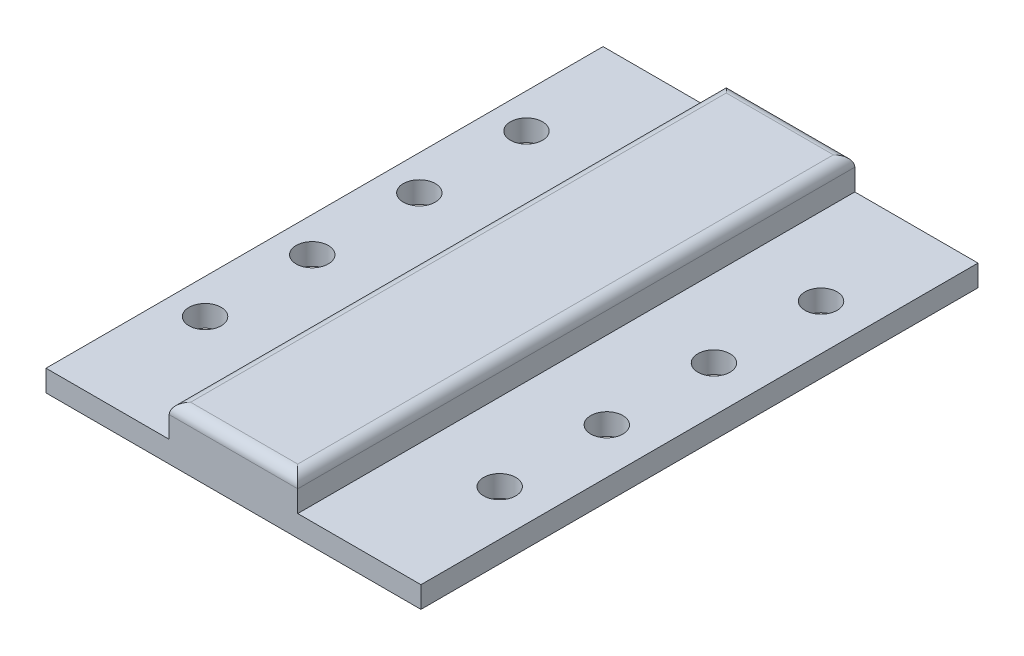
from build123d import *

# Parameters (mm, degrees)
SKETCH_1_W                  = 35
SKETCH_1_H                  = 52
EXTRUDE_1_DEPTH             = 2
EXTRUDE_2_REACH             = 33.405
SKETCH_2_W                  = 12
SKETCH_2_H                  = 3
EXTRUDE_2_DIRECTION_2_REACH = 33.405
SKETCH_3_R                  = 1.5
CUT_EXTRUDE_1_DEPTH         = 10
FILLET_1_R                  = 1


with BuildPart() as part:
    # Эскиз1 → Бобышка-Вытянуть1 (new body)
    with BuildSketch(Plane(origin=(0, 0, 0), x_dir=(1, 0, 0), z_dir=(0, 1, 0))):
        Rectangle(SKETCH_1_W, SKETCH_1_H)
    extrude(amount=EXTRUDE_1_DEPTH)

    # Бобышка-Вытянуть2: up to this face of the body (flat: up to its plane)
    extrude_2_end = Plane(part.part.faces().sort_by_distance((0, 1, 26))[0])
    # Эскиз2 → Бобышка-Вытянуть2 (add, up to the picked face)
    with BuildSketch(Plane.XY, mode=Mode.PRIVATE) as extrude_2_sk1:
        with Locations((0, 3.5)):
            Rectangle(SKETCH_2_W, SKETCH_2_H)
    extrude_2_tool1 = split(extrude(extrude_2_sk1.sketch, amount=EXTRUDE_2_REACH, mode=Mode.PRIVATE), bisect_by=extrude_2_end, keep=Keep.BOTH, mode=Mode.PRIVATE)
    add(extrude_2_tool1.solids().sort_by(Axis((0, 3.5, 0), (0, 0, 1)))[0])

    # Бобышка-Вытянуть2 direction 2: up to this face of the body (flat: up to its plane)
    extrude_2_direction_2_end = Plane(part.part.faces().sort_by_distance((0, 1, -26))[0])
    # Эскиз2 → Бобышка-Вытянуть2 direction 2 (add, up to the picked face)
    with BuildSketch(Plane.XY, mode=Mode.PRIVATE) as extrude_2_direction_2_sk1:
        with Locations((0, 3.5)):
            Rectangle(SKETCH_2_W, SKETCH_2_H)
    extrude_2_direction_2_tool1 = split(extrude(extrude_2_direction_2_sk1.sketch, amount=-EXTRUDE_2_DIRECTION_2_REACH, mode=Mode.PRIVATE), bisect_by=extrude_2_direction_2_end, keep=Keep.BOTH, mode=Mode.PRIVATE)
    add(extrude_2_direction_2_tool1.solids().sort_by(Axis((0, 3.5, 0), (0, 0, -1)))[0])

    # Эскиз3 → Вырез-Вытянуть1 (cut)
    with BuildSketch(Plane(origin=(0, 2, 0), x_dir=(1, 0, 0), z_dir=(0, 1, 0))):
        with Locations(Location((13.25, 15.6, 0), (0, 0, 270))):
            Circle(SKETCH_3_R)
        with Locations(Location((-14.25, 15.6, 0), (0, 0, 270))):
            Circle(SKETCH_3_R)
        with Locations(Location((-14.25, 5.6, 0), (0, 0, 270))):
            Circle(SKETCH_3_R)
        with Locations(Location((13.25, 5.6, 0), (0, 0, 270))):
            Circle(SKETCH_3_R)
        with Locations(Location((-14.25, -4.4, 0), (0, 0, 270))):
            Circle(SKETCH_3_R)
        with Locations(Location((13.25, -4.4, 0), (0, 0, 270))):
            Circle(SKETCH_3_R)
        with Locations(Location((-14.25, -14.4, 0), (0, 0, 270))):
            Circle(SKETCH_3_R)
        with Locations(Location((13.25, -14.4, 0), (0, 0, 270))):
            Circle(SKETCH_3_R)
    extrude(amount=-CUT_EXTRUDE_1_DEPTH, mode=Mode.SUBTRACT)

    # Скругление1
    fillet_1_edges = [part.edges().sort_by_distance(p)[0] for p in [
        (0, 5, 26),
        (6, 5, 0),
        (-6, 5, 0),
        (0, 5, -26),
    ]]
    fillet(fillet_1_edges, radius=FILLET_1_R)


solid = part.part
